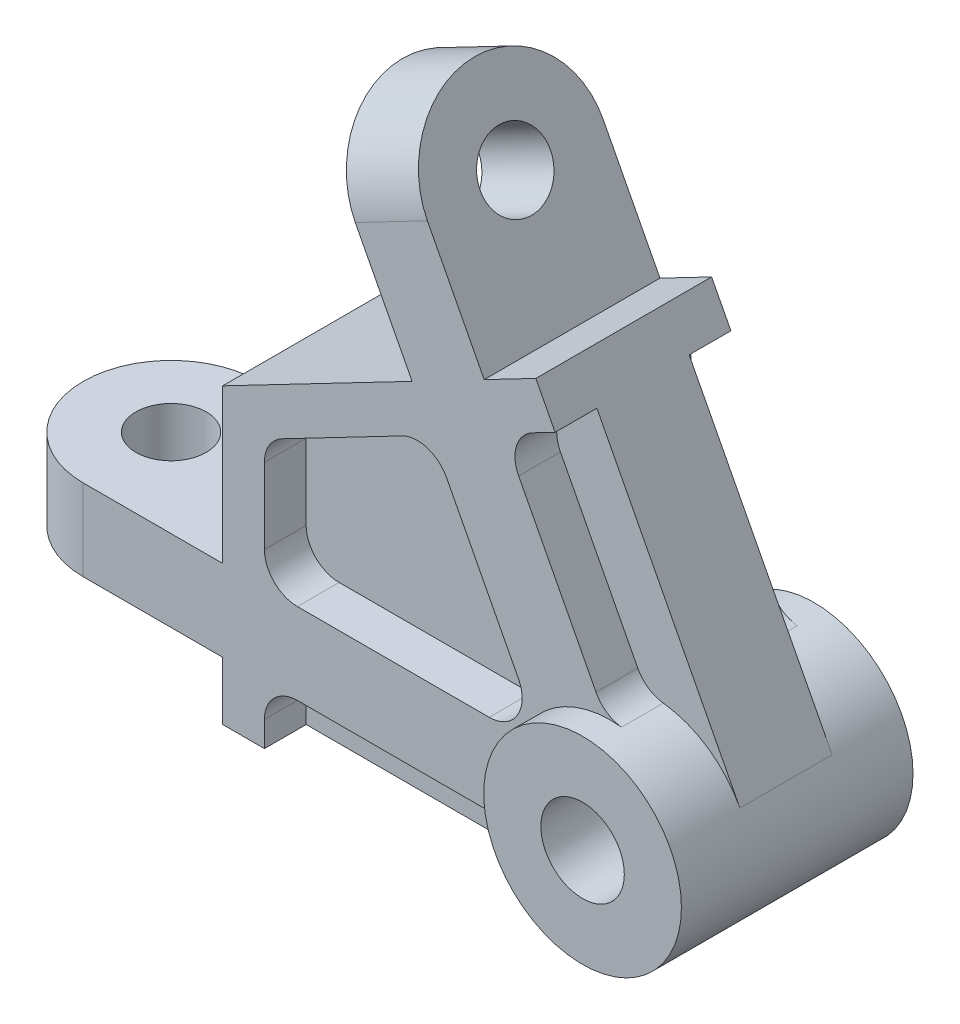
from build123d import *
from build123d.topology import SkipClean

# Parameters (mm, degrees)
BOSS_EXTRU_1_DEPTH       = 20
ESQUISSE4_R              = 22.5
BOSS_EXTRU_2_DEPTH       = 26.35
ESQUISSE6_R              = 9.5
ENL_V_MAT_EXTRU_1_DEPTH  = 174.395073781
ENL_V_MAT_EXTRU_2_DEPTH  = 9.5
CONG_1_R                 = 7.5
ENL_V_START              = -9.5
ENL_V_MAT_EXTRU_10_DEPTH = 9.5
ENL_V_MAT_EXTRU_6_DEPTH  = 9.5
CONG_3_R                 = 7.5
ENL_V_MAT_EXTRU_7_DEPTH  = 9.5
CONG_4_R                 = 7.5
BOSS_EXTRU_4_DEPTH       = 18.5
ESQUISSE14_R             = 8
ENL_V_MAT_EXTRU_8_DEPTH  = 146.629175394
BOSS_EXTRU_5_DEPTH       = 18.5
ESQUISSE16_R             = 8
ENL_V_MAT_EXTRU_9_DEPTH  = 171.14276454


with BuildPart() as part:
    # Esquisse2 → Boss.-Extru.1 (new, symmetric)
    with BuildSketch(Plane.XY):
        with BuildLine():
            Line((0, 0), (88.25, 0))
            ThreePointArc((88.25, 0), (69.01448291, 34.172398309), (108.207743747, 32.889343798))
            Line((108.207743747, 32.889343798), (71.268065021, 103.849806406))
            Line((71.268065021, 103.849806406), (59.515171481, 97.731637281))
            Line((59.515171481, 97.731637281), (46.585999978, 122.568344656))
            Line((46.585999978, 122.568344656), (30.176299564, 114.025995311))
            Line((30.176299564, 114.025995311), (43.105471067, 89.189287936))
            Line((43.105471067, 89.189287936), (0, 66.75))
            Line((0, 66.75), (0, 31.75))
            Line((0, 31.75), (-31.75, 31.75))
            Line((-31.75, 31.75), (-31.75, 13.25))
            Line((-31.75, 13.25), (0, 13.25))
            Line((0, 13.25), (0, 0))
        make_face()
    extrude(amount=BOSS_EXTRU_1_DEPTH, both=True)

    # Esquisse4 → Boss.-Extru.2 (add, symmetric)
    with BuildSketch(Plane.XY):
        with Locations((88.25, 22.5)):
            Circle(ESQUISSE4_R)
    extrude(amount=BOSS_EXTRU_2_DEPTH, both=True)

    # Esquisse6 → Enlèv. mat.-Extru.1 (cut, through all)
    with BuildSketch(Plane.XY.offset(26.35)):
        with Locations((88.25, 22.5)):
            Circle(ESQUISSE6_R)
    extrude(amount=-ENL_V_MAT_EXTRU_1_DEPTH, mode=Mode.SUBTRACT)

    # Esquisse7 → Enlèv. mat.-Extru.2 (cut)
    with SkipClean():  # the faces are left unmerged after this step: merging them gives an invalid solid
        with BuildSketch(Plane.XY.offset(20)):
            with BuildLine():
                Line((9.5, 0), (9.5, 13.25))
                Line((9.5, 13.25), (63.361498639, 13.25))
                ThreePointArc((63.361498639, 13.25), (66.885966684, 12.370281338), (69.583623979, 9.9375))
                ThreePointArc((69.583623979, 9.9375), (77.676595865, 2.639155985), (88.25, 0))
                Line((88.25, 0), (9.5, 0))
            make_face()
        extrude(amount=-ENL_V_MAT_EXTRU_2_DEPTH, mode=Mode.SUBTRACT)

    # Congé1
    cong_1_edges = [part.edges().sort_by_distance(p)[0] for p in [
        (9.5, 13.25, 15.25),
    ]]
    fillet(cong_1_edges, radius=CONG_1_R)

    # Esquisse18 → Enlèv. mat.-Extru.10 (cut)
    with BuildSketch(Plane(origin=(0, 0, -20), x_dir=(-1, 0, 0), z_dir=(0, 0, -1)).offset(ENL_V_START)):
        with BuildLine():
            Line((-9.5, 0), (-88.25, 0))
            ThreePointArc((-88.25, 0), (-77.676595865, 2.639155985), (-69.583623979, 9.9375))
            ThreePointArc((-69.583623979, 9.9375), (-66.885966684, 12.370281338), (-63.361498639, 13.25))
            Line((-63.361498639, 13.25), (-9.5, 13.25))
            Line((-9.5, 13.25), (-9.5, 0))
        make_face()
    extrude(amount=ENL_V_MAT_EXTRU_10_DEPTH, mode=Mode.SUBTRACT)

    # Esquisse11 → Enlèv. mat.-Extru.6 (cut)
    with BuildSketch(Plane.XY.offset(20)):
        with BuildLine():
            Line((47.492082893, 80.762685021), (67.299435542, 42.713114599))
            ThreePointArc((67.299435542, 42.713114599), (67.058693323, 35.359200564), (60.646854293, 31.75))
            Line((60.646854293, 31.75), (9.5, 31.75))
            Line((9.5, 31.75), (9.5, 60.985258485))
            Line((9.5, 60.985258485), (47.492082893, 80.762685021))
        make_face()
        with BuildLine():
            Line((63.901783307, 89.305034366), (84.962619218, 48.847545001))
            ThreePointArc((84.962619218, 48.847545001), (87.370357433, 46.127512536), (90.77390035, 44.8579947))
            ThreePointArc((90.77390035, 44.8579947), (100.984529101, 41.049441193), (108.207743747, 32.889343798))
            Line((108.207743747, 32.889343798), (75.654676846, 95.423203491))
            Line((75.654676846, 95.423203491), (63.901783307, 89.305034366))
        make_face()
    extrude(amount=-ENL_V_MAT_EXTRU_6_DEPTH, mode=Mode.SUBTRACT)

    # Congé3
    cong_3_edges = [part.edges().sort_by_distance(p)[0] for p in [
        (63.901783307, 89.305034366, 15.25),
        (9.5, 60.985258485, 15.25),
        (47.492082893, 80.762685021, 15.25),
        (9.5, 31.75, 15.25),
    ]]
    fillet(cong_3_edges, radius=CONG_3_R)

    # Esquisse12 → Enlèv. mat.-Extru.7 (cut)
    with BuildSketch(Plane(origin=(0, 0, -20), x_dir=(-1, 0, 0), z_dir=(0, 0, -1)).offset(ENL_V_START)):
        with BuildLine():
            Line((-75.654676846, 95.423203491), (-108.207743747, 32.889343798))
            ThreePointArc((-108.207743747, 32.889343798), (-100.984529101, 41.049441193), (-90.77390035, 44.8579947))
            ThreePointArc((-90.77390035, 44.8579947), (-87.370357433, 46.127512536), (-84.962619218, 48.847545001))
            Line((-84.962619218, 48.847545001), (-63.901783307, 89.305034366))
            Line((-63.901783307, 89.305034366), (-75.654676846, 95.423203491))
        make_face()
        with BuildLine():
            Line((-9.5, 31.75), (-9.5, 60.985258485))
            Line((-9.5, 60.985258485), (-47.492082893, 80.762685021))
            Line((-47.492082893, 80.762685021), (-67.299435542, 42.713114599))
            ThreePointArc((-67.299435542, 42.713114599), (-67.058693323, 35.359200564), (-60.646854293, 31.75))
            Line((-60.646854293, 31.75), (-9.5, 31.75))
        make_face()
    extrude(amount=ENL_V_MAT_EXTRU_7_DEPTH, mode=Mode.SUBTRACT)

    # Congé4
    cong_4_edges = [part.edges().sort_by_distance(p)[0] for p in [
        (9.5, 31.75, -15.25),
        (47.492082893, 80.762685021, -15.25),
        (9.5, 60.985258485, -15.25),
        (63.901783307, 89.305034366, -15.25),
    ]]
    fillet(cong_4_edges, radius=CONG_4_R)

    # Esquisse13 → Boss.-Extru.4 (add)
    with BuildSketch(Plane(origin=(0, 31.75, 0), x_dir=(1, 0, 0), z_dir=(0, 1, 0))):
        with BuildLine():
            Line((-31.75, -20), (-31.75, 20))
            ThreePointArc((-31.75, 20), (-51.75, 0), (-31.75, -20))
        make_face()
    extrude(amount=-BOSS_EXTRU_4_DEPTH)

    # Esquisse14 → Enlèv. mat.-Extru.8 (cut, through all)
    with BuildSketch(Plane(origin=(0, 31.75, 0), x_dir=(1, 0, 0), z_dir=(0, 1, 0))):
        with Locations(Location((-31.75, 0, 0), (0, 0, 270))):
            Circle(ESQUISSE14_R)
    extrude(amount=-ENL_V_MAT_EXTRU_8_DEPTH, mode=Mode.SUBTRACT)

    # Esquisse15 → Boss.-Extru.5 (add)
    with BuildSketch(Plane(origin=(86.854370959, 45.213523718, 0), x_dir=(0, 0, -1), z_dir=(0.8870108331782227, 0.4617486132350318, 0))):
        with BuildLine():
            Line((-20, 87.208428629), (20, 87.208428629))
            ThreePointArc((20, 87.208428629), (0, 107.208428629), (-20, 87.208428629))
        make_face()
    extrude(amount=-BOSS_EXTRU_5_DEPTH)

    # Esquisse16 → Enlèv. mat.-Extru.9 (cut, through all)
    with BuildSketch(Plane(origin=(86.854370959, 45.213523718, 0), x_dir=(0, 0, -1), z_dir=(0.8870108331782227, 0.4617486132350318, 0))):
        with Locations(Location((0, 87.208428629, 0), (0, 0, 90))):
            Circle(ESQUISSE16_R)
    extrude(amount=-ENL_V_MAT_EXTRU_9_DEPTH, mode=Mode.SUBTRACT)


solid = part.part
